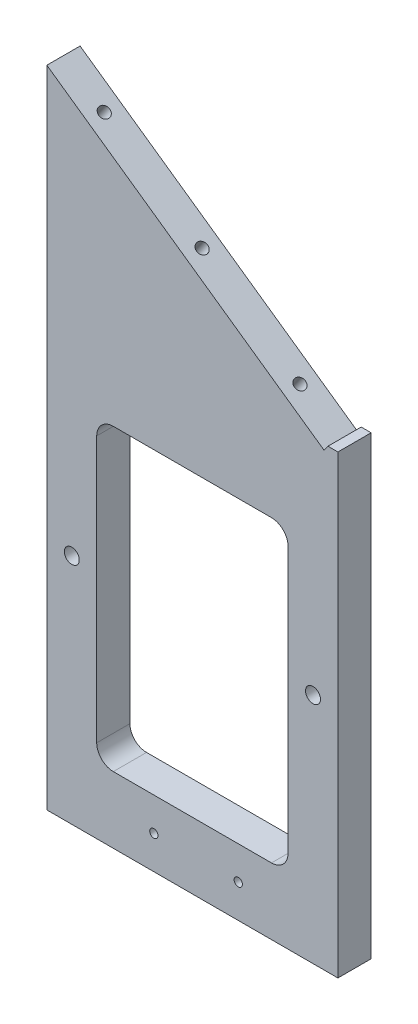
from build123d import *

# Parameters (mm, degrees)
EXTRUDE_1_DEPTH        = 10
PATTERN_LINEAR_1_COUNT = 3
PATTERN_LINEAR_1_PITCH = 36
CUT_EXTRUDE_1_DEPTH    = 160.432744146
PATTERN_LINEAR_2_COUNT = 3
PATTERN_LINEAR_2_PITCH = 33.8
SKETCH_7_R             = 2.25
CUT_EXTRUDE_2_DEPTH    = 160.432744146
HOLE_WIZARD_M3_1_D     = 2.5
PATTERN_LINEAR_3_COUNT = 2
PATTERN_LINEAR_3_PITCH = 25.4


with BuildPart() as part:
    # 草图1 → 凸台-拉伸1 (new body)
    with BuildSketch(Plane.XY):
        Polygon((0, 0), (-83.451271177, 58.650535708), (-83.451271177, -135.479464292), (4.150010504, -135.479464292), (4.150010504, 1.636299435), (1.150010504, 1.636299435), align=None)
    extrude(amount=EXTRUDE_1_DEPTH)

    # 草图2 → M4 螺纹孔1 (revolve, cut)
    with BuildSketch(Plane(origin=(-12.272245761, 8.625078781, 5), x_dir=(-0.8181497174250271, 0.5750052520432736, 0), z_dir=(0, 0, 1))):
        Polygon((0, 0), (0, 11.091420021), (1.65, 10.1), (1.65, 0), align=None)
    hole_wizard_m4_1 = revolve(axis=Axis((-8.620962411, 13.820329486, 5), (-0.5750052520432737, -0.818149717425027, 0)), mode=Mode.SUBTRACT)

    # 阵列(线性)1: M4 螺纹孔1 ×3
    with Locations(*[Vector(-0.8181497174250268, 0.5750052520432738, 0) * (i * PATTERN_LINEAR_1_PITCH) for i in range(1, PATTERN_LINEAR_1_COUNT)]):
        add(hole_wizard_m4_1, mode=Mode.SUBTRACT)

    # 草图4 → 切除-拉伸1 (cut, through all)
    with BuildSketch(Plane.XY.offset(10)):
        with BuildLine():
            Line((-63.451271177, -115.479464292), (-15.849989496, -115.479464292))
            ThreePointArc((-15.849989496, -115.479464292), (-12.31445559, -114.014998198), (-10.849989496, -110.479464292))
            Line((-10.849989496, -110.479464292), (-10.849989496, -30.479464292))
            ThreePointArc((-10.849989496, -30.479464292), (-12.31445559, -26.943930386), (-15.849989496, -25.479464292))
            Line((-15.849989496, -25.479464292), (-63.451271177, -25.479464292))
            ThreePointArc((-63.451271177, -25.479464292), (-66.986805083, -26.943930386), (-68.451271177, -30.479464292))
            Line((-68.451271177, -30.479464292), (-68.451271177, -110.479464292))
            ThreePointArc((-68.451271177, -110.479464292), (-66.986805083, -114.014998198), (-63.451271177, -115.479464292))
        make_face()
    extrude(amount=-CUT_EXTRUDE_1_DEPTH, mode=Mode.SUBTRACT)

    # 草图5 → M6 螺纹孔1 (revolve, cut)
    with BuildSketch(Plane(origin=(-5.849989496, -135.479464292, 5), x_dir=(0, 0, -1), z_dir=(1, 0, 0))):
        Polygon((0, 0), (0, 16.502151548), (2.5, 15), (2.5, 0), align=None)
    hole_wizard_m6_1 = revolve(axis=Axis((-5.849989496, -141.829464292, 5), (0, 1, 0)), mode=Mode.SUBTRACT)

    # 阵列(线性)2: M6 螺纹孔1 ×3
    with Locations(*[(-i * PATTERN_LINEAR_2_PITCH, 0, 0) for i in range(1, PATTERN_LINEAR_2_COUNT)]):
        add(hole_wizard_m6_1, mode=Mode.SUBTRACT)

    # 草图7 → 切除-拉伸2 (cut, through all)
    with BuildSketch(Plane.XY.offset(10)):
        with Locations((-75.951271177, -65.479464292)):
            Circle(SKETCH_7_R)
        with Locations((-3.349989496, -65.479464292)):
            Circle(SKETCH_7_R)
    extrude(amount=-CUT_EXTRUDE_2_DEPTH, mode=Mode.SUBTRACT)

    # M3 螺纹孔1 (through all)
    with Locations(Plane(origin=(0, 0, 0), x_dir=(-1, 0, 0), z_dir=(0, 0, -1))):
        with Locations((25.849989496, -125.479464292)):
            hole_wizard_m3_1 = Hole(HOLE_WIZARD_M3_1_D / 2)

    # 阵列(线性)3: M3 螺纹孔1 ×2
    with Locations(*[(-i * PATTERN_LINEAR_3_PITCH, 0, 0) for i in range(1, PATTERN_LINEAR_3_COUNT)]):
        add(hole_wizard_m3_1, mode=Mode.SUBTRACT)


solid = part.part
